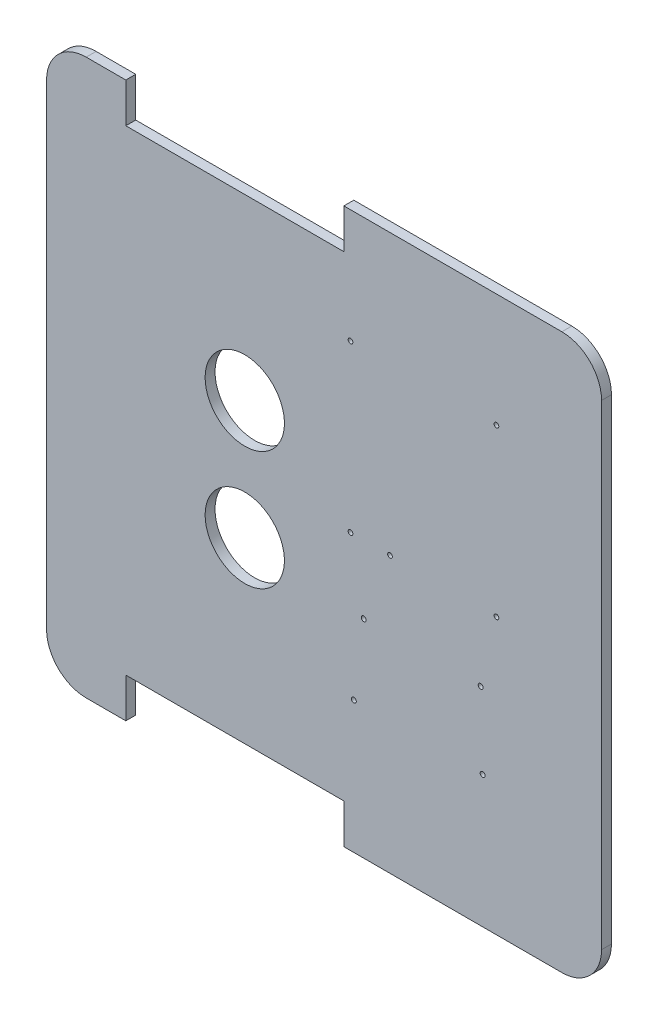
from build123d import *

# Parameters (mm, degrees)
BOSS_EXTRUDE1_DEPTH = 6.35
SKETCH2_W           = 139.7
SKETCH2_H           = 25.4
CUT_EXTRUDE1_DEPTH  = 503.934431611
SKETCH4_R           = 1.5875
SKETCH4_R_2         = 1.5
SKETCH4_R_3         = 25.4
CUT_EXTRUDE2_DEPTH  = 503.934431611


with BuildPart() as part:
    # Sketch1 → Boss-Extrude1 (new body)
    with BuildSketch(Plane.XY):
        with BuildLine():
            Line((25.4, 0), (330.2, 0))
            ThreePointArc((330.2, 0), (348.160512242, 7.439487758), (355.6, 25.4))
            Line((355.6, 25.4), (355.6, 330.2))
            ThreePointArc((355.6, 330.2), (348.160512242, 348.160512242), (330.2, 355.6))
            Line((330.2, 355.6), (25.4, 355.6))
            ThreePointArc((25.4, 355.6), (7.439487758, 348.160512242), (0, 330.2))
            Line((0, 330.2), (0, 25.4))
            ThreePointArc((0, 25.4), (7.439487758, 7.439487758), (25.4, 0))
        make_face()
    extrude(amount=BOSS_EXTRUDE1_DEPTH)

    # Sketch2 → Cut-Extrude1 (cut, through all)
    with BuildSketch(Plane(origin=(0, 0, 0), x_dir=(-1, 0, 0), z_dir=(0, 0, -1))):
        with Locations((-120.65, 342.9)):
            Rectangle(SKETCH2_W, SKETCH2_H)
        with Locations((-120.65, 12.7)):
            Rectangle(SKETCH2_W, SKETCH2_H)
    extrude(amount=-CUT_EXTRUDE1_DEPTH, mode=Mode.SUBTRACT)

    # Sketch4 → Cut-Extrude2 (cut, through all)
    with BuildSketch(Plane(origin=(0, 0, 0), x_dir=(-1, 0, 0), z_dir=(0, 0, -1))):
        with Locations((-279.42318149, 84.573787042)):
            Circle(SKETCH4_R)
        with Locations((-278.15318149, 132.833787042)):
            Circle(SKETCH4_R)
        with Locations((-196.87318149, 84.573787042)):
            Circle(SKETCH4_R)
        with Locations((-203.22318149, 132.833787042)):
            Circle(SKETCH4_R)
        with Locations((-288.258815439, 176.472066732)):
            Circle(SKETCH4_R_2)
        with Locations((-220.058815439, 176.472066732)):
            Circle(SKETCH4_R_2)
        with Locations((-194.758815439, 176.472066732)):
            Circle(SKETCH4_R_2)
        with Locations((-288.258815439, 282.772066732)):
            Circle(SKETCH4_R_2)
        with Locations((-194.758815439, 282.772066732)):
            Circle(SKETCH4_R_2)
        with Locations((-127, 215.9)):
            Circle(SKETCH4_R_3)
        with Locations((-127, 139.7)):
            Circle(SKETCH4_R_3)
    extrude(amount=-CUT_EXTRUDE2_DEPTH, mode=Mode.SUBTRACT)


solid = part.part
